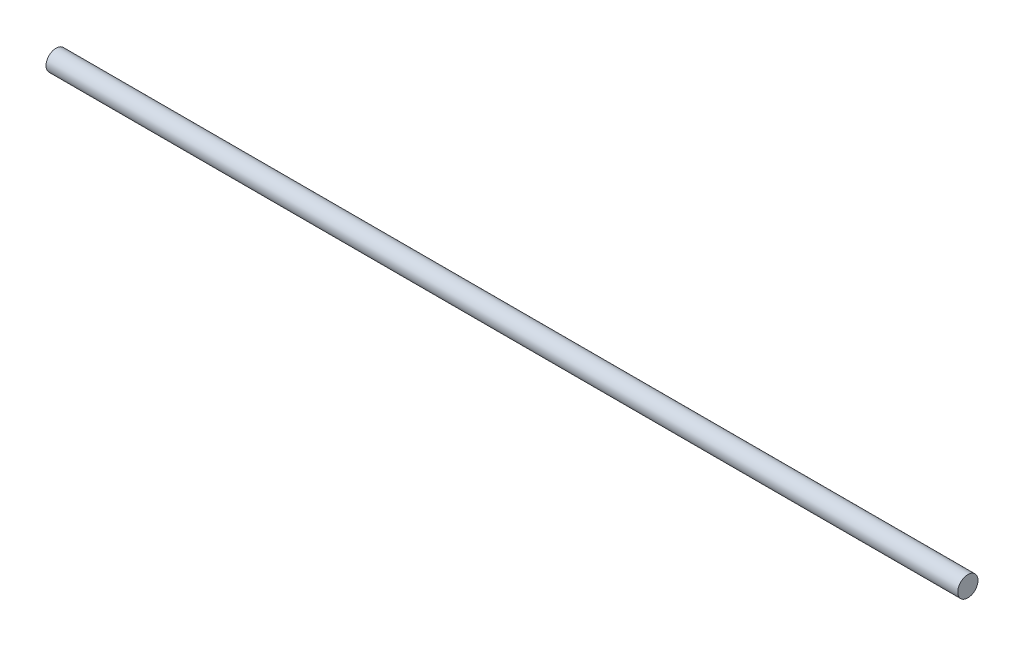
from build123d import *

# Parameters (mm, degrees)
SKETCH1_R           = 3.81
BOSS_EXTRUDE1_DEPTH = 342.9


with BuildPart() as part:
    # Sketch1 → Boss-Extrude1 (new body)
    with BuildSketch(Plane(origin=(0, 0, 0), x_dir=(0, 0, -1), z_dir=(1, 0, 0))):
        Circle(SKETCH1_R)
    extrude(amount=BOSS_EXTRUDE1_DEPTH)


solid = part.part
